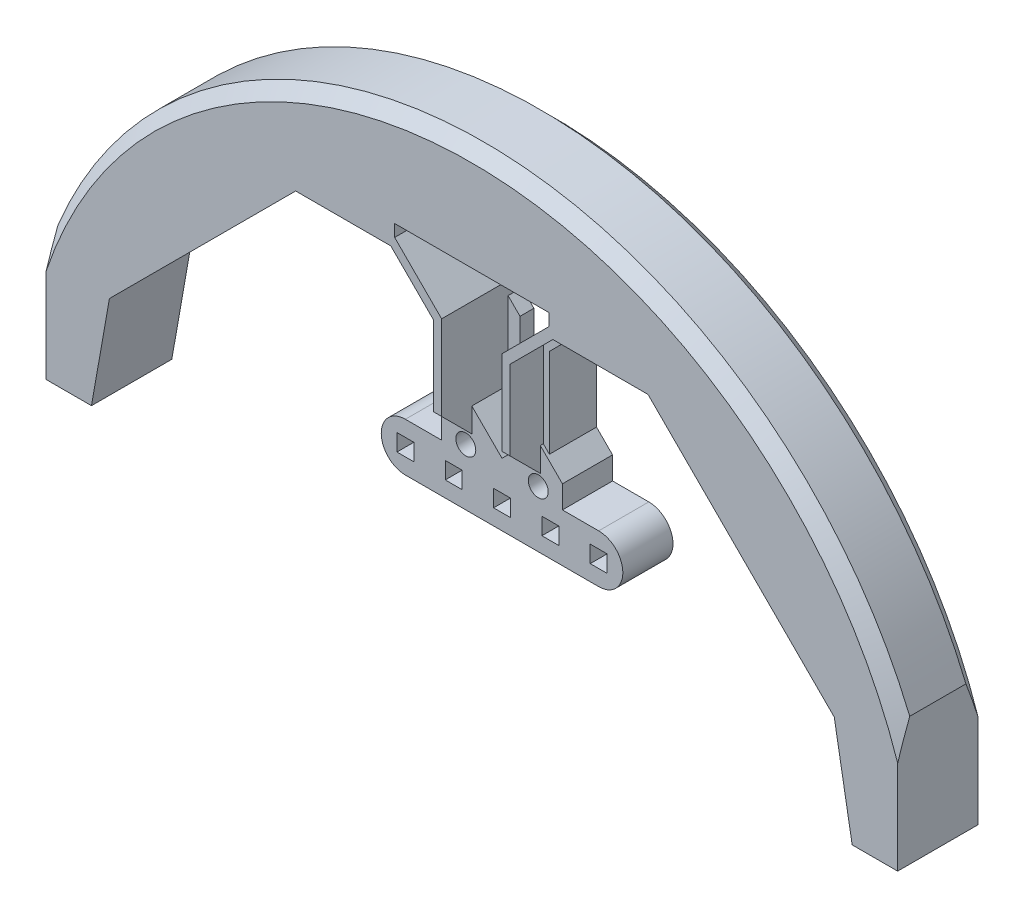
from build123d import *

# Parameters (mm, degrees)
ESBO_O4_R                 = 1.65
RESSALTO_EXTRUS_O1_DEPTH  = 2.3
RESSALTO_EXTRUS_O2_DEPTH  = 3.5
RESSALTO_EXTRUS_O3_DEPTH  = 11
CORTE_EXTRUS_O1_DEPTH     = 10.5
CORTE_EXTRUS_O2_DEPTH     = 40.5
RESSALTO_EXTRUS_O4_DEPTH  = 2
CHANFRO1_SIZE             = 1
ESBO_O11_R                = 1.65
RESSALTO_EXTRUS_O5_DEPTH  = 6
RESSALTO_EXTRUS_O6_DEPTH  = 7
CORTE_EXTRUS_O3_DEPTH     = 94.096670187
RESSALTO_EXTRUS_O7_DEPTH  = 2.3
ESBO_O16_W                = 2.8
ESBO_O16_H                = 2.8
RESSALTO_EXTRUS_O8_DEPTH  = 8.3
ESBO_O17_W                = 2.8
ESBO_O17_H                = 2.8
CORTE_EXTRUS_O4_DEPTH     = 94.002096751
CORTE_EXTRUS_O5_DEPTH     = 11
RESSALTO_EXTRUS_O9_DEPTH  = 2.3
RESSALTO_EXTRUS_O10_DEPTH = 11
RESSALTO_EXTRUS_O11_DEPTH = 2
RESSALTO_EXTRUS_O12_DEPTH = 9
RESSALTO_EXTRUS_O13_DEPTH = 5
CORTE_EXTRUS_O6_REACH     = 107.129
ESBO_O26_W                = 10.5
ESBO_O26_H                = 1.2
RESSALTO_EXTRUS_O14_DEPTH = 11
CORTE_EXTRUS_O7_DEPTH     = 101.585237485
RESSALTO_EXTRUS_O15_DEPTH = 11
RESSALTO_EXTRUS_O16_DEPTH = 13.3
CORTE_EXTRUS_O8_START     = -11
CORTE_EXTRUS_O8_DEPTH     = 11
RESSALTO_EXTRUS_O17_START = -2
RESSALTO_EXTRUS_O17_DEPTH = 2
CHANFRO2_SIZE             = 2
CHANFRO3_SIZE             = 2
RESSALTO_EXTRUS_O18_DEPTH = 2.3
RESSALTO_EXTRUS_O19_DEPTH = 3.5
RESSALTO_EXTRUS_O20_DEPTH = 2
RESSALTO_EXTRUS_O23_DEPTH = 1.5


with BuildPart() as part:
    # Esboço4 → Ressalto-extrusão1 (new body)
    with BuildSketch(Plane.XY):
        Polygon((70, 0), (70, 28.994949366), (28.994949366, 70), (-28.994949366, 70), (-70, 28.994949366), (-70, 0), (-60, 0), (-60, 24.852813742), (-42.426406871, 42.426406871), (-31.166522241, 53.686291501), (-14.242640687, 53.686291501), (-10, 49.443650814), (-10, 24.443650814), (10, 24.443650814), (10, 49.443650814), (14.242640687, 53.686291501), (31.166522241, 53.686291501), (42.426406871, 42.426406871), (60, 24.852813742), (60, 0), align=None)
        with Locations((6, 28.443650814)):
            Circle(ESBO_O4_R, mode=Mode.SUBTRACT)
        with Locations(Location((-6, 28.443650814, 0), (0, 0, 180))):
            Circle(ESBO_O4_R, mode=Mode.SUBTRACT)
        Polygon((-9.894556364, 62.105443636), (9.894556364, 62.105443636), (12.778174593, 59.221825407), (12.778174593, 57.221825407), (5, 49.443650814), (5, 34.443650814), (0, 29.443650814), (-5, 34.443650814), (-5, 49.443650814), (-12.778174593, 57.221825407), (-12.778174593, 59.221825407), align=None, mode=Mode.SUBTRACT)
    extrude(amount=RESSALTO_EXTRUS_O1_DEPTH)

    # Esboço6 → Ressalto-extrusão2 (add)
    with BuildSketch(Plane.XY.offset(2.3)):
        Polygon((-10, 49.443650814), (-14.242640687, 53.686291501), (-31.166522241, 53.686291501), (-35.409162928, 49.443650814), (-36.823376491, 50.857864376), (-31.994949366, 55.686291501), (-31.166522241, 55.686291501), (-13.414213562, 55.686291501), (-8.585786438, 50.857864376), align=None)
        Polygon((8.585786438, 50.857864376), (13.414213562, 55.686291501), (31.166522241, 55.686291501), (31.994949366, 55.686291501), (36.823376491, 50.857864376), (35.409162928, 49.443650814), (31.166522241, 53.686291501), (14.242640687, 53.686291501), (10, 49.443650814), align=None)
    extrude(amount=RESSALTO_EXTRUS_O2_DEPTH)

    # Esboço7 → Ressalto-extrusão3 (add)
    with BuildSketch(Plane.XY.offset(2.3)):
        Polygon((27.130988335, 65.5), (-27.130988335, 65.5), (-65.5, 27.130988335), (-65.5, 0), (-62.5, 0), (-62.5, 25.888347648), (-25.888347648, 62.5), (25.888347648, 62.5), (62.5, 25.888347648), (62.5, 0), (65.5, 0), (65.5, 27.130988335), align=None)
    extrude(amount=RESSALTO_EXTRUS_O3_DEPTH)

    # Esboço8 → Corte-extrusão1 (cut)
    with BuildSketch(Plane.XY.offset(2.3)):
        Polygon((-65.5, 0), (-65.5, 27.130988335), (-27.130988335, 65.5), (27.130988335, 65.5), (65.5, 27.130988335), (65.5, 0), (65.5, -7.47317723), (91.763905533, -7.47317723), (91.763905533, 81.084833901), (-91.763905533, 81.084833901), (-91.763905533, -7.47317723), (-65.5, -7.47317723), align=None)
    extrude(amount=-CORTE_EXTRUS_O1_DEPTH, mode=Mode.SUBTRACT)

    # Esboço9 → Corte-extrusão2 (cut)
    with BuildSketch(Plane(origin=(0, 0, 0), x_dir=(-1, 0, 0), z_dir=(0, 0, -1))):
        Polygon((60, 0), (70, 0), (70, 8.000623443), (-93.298268705, 8.000623443), (-93.298268705, 0), align=None)
    extrude(amount=-CORTE_EXTRUS_O2_DEPTH, mode=Mode.SUBTRACT)

    # Esboço10 → Ressalto-extrusão4 (add)
    with BuildSketch(Plane.XY.offset(13.3)):
        Polygon((-62.5, 8.000623443), (-62.5, 25.888347648), (-25.888347648, 62.5), (25.888347648, 62.5), (62.5, 25.888347648), (62.5, 8.000623443), (60, 8.000623443), (60, 24.852813742), (24.852813742, 60), (-24.852813742, 60), (-60, 24.852813742), (-60, 8.000623443), align=None)
    extrude(amount=-RESSALTO_EXTRUS_O4_DEPTH)

    # Chanfro1
    chanfro1_edges = [part.edges().sort_by_distance(p)[0] for p in [
        (-62.5, 16.944485546, 11.3),
        (-44.194173824, 44.194173824, 11.3),
        (0, 62.5, 11.3),
        (44.194173824, 44.194173824, 11.3),
        (62.5, 16.944485546, 11.3),
    ]]
    chamfer(chanfro1_edges, length=CHANFRO1_SIZE)

    # Esboço11 → Ressalto-extrusão5 (add)
    with BuildSketch(Plane.XY.offset(2.3)):
        Polygon((-10, 24.443650814), (10, 24.443650814), (10, 34.443650814), (5, 34.443650814), (0, 29.443650814), (-5, 34.443650814), (-10, 34.443650814), align=None)
        with Locations(Location((-6, 28.443650814, 0), (0, 0, 180))):
            Circle(ESBO_O11_R, mode=Mode.SUBTRACT)
        with Locations((6, 28.443650814)):
            Circle(ESBO_O11_R, mode=Mode.SUBTRACT)
    extrude(amount=RESSALTO_EXTRUS_O5_DEPTH)

    # Esboço12 → Ressalto-extrusão6 (add)
    with BuildSketch(Plane.XY.offset(2.3)):
        Polygon((-5, 34.443650814), (-5, 49.443650814), (-12.778174593, 57.221825407), (-12.778174593, 62.936367936), (-14.778174593, 62.936367936), (-14.778174593, 55.686291501), (-13.414213562, 55.686291501), (-6.343145751, 48.615223689), (-6.343145751, 34.443650814), align=None)
        Polygon((6.343145751, 34.443650814), (5, 34.443650814), (5, 49.443650814), (12.778174593, 57.221825407), (12.778174593, 62.936367936), (14.778174593, 62.936367936), (14.778174593, 55.686291501), (13.414213562, 55.686291501), (6.343145751, 48.615223689), align=None)
    extrude(amount=RESSALTO_EXTRUS_O6_DEPTH)

    # Esboço14 → Corte-extrusão3 (cut, through all)
    with BuildSketch(Plane.XY.offset(9.3)):
        Polygon((14.242640687, 53.686291501), (12.828427125, 53.686291501), (6.343145751, 47.201010127), (6.343145751, 34.443650814), (18.19110406, 22.595692505), align=None)
        Polygon((-14.242640687, 53.686291501), (-18.19110406, 22.595692505), (-6.343145751, 34.443650814), (-6.343145751, 47.201010127), (-12.828427125, 53.686291501), align=None)
    extrude(amount=-CORTE_EXTRUS_O3_DEPTH, mode=Mode.SUBTRACT)

    # Esboço15 → Ressalto-extrusão7 (add)
    with BuildSketch(Plane.XY.offset(2.3)):
        Polygon((-5, 47.272077939), (-3.023616976, 45.295694915), (-3.023616976, 32.46726779), (-5, 34.443650814), align=None)
        Polygon((5, 34.443650814), (5, 47.272077939), (3.023616976, 45.295694915), (3.023616976, 32.46726779), align=None)
    extrude(amount=-RESSALTO_EXTRUS_O7_DEPTH)

    # Esboço16 → Ressalto-extrusão8 (add)
    with BuildSketch(Plane(origin=(0, 0, 0), x_dir=(-1, 0, 0), z_dir=(0, 0, -1))):
        with BuildLine():
            Line((-16, 27.043650814), (-10, 27.043650814))
            Line((-10, 27.043650814), (-10, 24.443650814))
            Line((-10, 24.443650814), (10, 24.443650814))
            Line((10, 24.443650814), (10, 27.043650814))
            Line((10, 27.043650814), (16, 27.043650814))
            ThreePointArc((16, 27.043650814), (20, 23.043650814), (16, 19.043650814))
            Line((16, 19.043650814), (-16, 19.043650814))
            ThreePointArc((-16, 19.043650814), (-20, 23.043650814), (-16, 27.043650814))
        make_face()
        with Locations((-16, 23.043650814)):
            Rectangle(ESBO_O16_W, ESBO_O16_H, mode=Mode.SUBTRACT)
        with Locations((16, 23.043650814)):
            Rectangle(ESBO_O16_W, ESBO_O16_H, mode=Mode.SUBTRACT)
    extrude(amount=-RESSALTO_EXTRUS_O8_DEPTH)

    # Esboço17 → Corte-extrusão4 (cut, through all)
    with BuildSketch(Plane.XY.offset(8.3)):
        with Locations((0, 23.043650814)):
            Rectangle(ESBO_O17_W, ESBO_O17_H)
        with Locations((-8, 23.043650814)):
            Rectangle(ESBO_O17_W, ESBO_O17_H)
        with Locations((8, 23.043650814)):
            Rectangle(ESBO_O17_W, ESBO_O17_H)
    extrude(amount=-CORTE_EXTRUS_O4_DEPTH, mode=Mode.SUBTRACT)

    # Esboço18 → Corte-extrusão5 (cut)
    with BuildSketch(Plane.XY.offset(13.3)):
        Polygon((14.778174593, 60), (24.852813742, 60), (60, 24.852813742), (60, 8.000623443), (65.5, 8.000623443), (65.5, 27.130988335), (27.130988335, 65.5), (14.778174593, 65.5), (14.778174593, 62.5), align=None)
        Polygon((-27.130988335, 65.5), (-65.5, 27.130988335), (-65.5, 8.000623443), (-60, 8.000623443), (-60, 24.852813742), (-24.852813742, 60), (-14.778174593, 60), (-14.778174593, 62.5), (-14.778174593, 65.5), align=None)
        Polygon((12.778174593, 65.5), (-12.778174593, 65.5), (-12.778174593, 62.5), (-12.778174593, 60), (12.778174593, 60), (12.778174593, 62.5), align=None)
    extrude(amount=-CORTE_EXTRUS_O5_DEPTH, mode=Mode.SUBTRACT)

    # Esboço19 → Ressalto-extrusão9 (add)
    with BuildSketch(Plane(origin=(0, 0, 0), x_dir=(-1, 0, 0), z_dir=(0, 0, -1))):
        Polygon((-65.5, 27.130988335), (-65.5, 8.000623443), (-70.5, 8.000623443), (-70.5, 29.202056147), (-29.202056147, 70.5), (29.202056147, 70.5), (70.5, 29.202056147), (70.5, 8.000623443), (65.5, 8.000623443), (65.5, 27.130988335), (27.130988335, 65.5), (-27.130988335, 65.5), align=None)
    extrude(amount=-RESSALTO_EXTRUS_O9_DEPTH)

    # Esboço20 → Ressalto-extrusão10 (add)
    with BuildSketch(Plane.XY.offset(2.3)):
        Polygon((-70.5, 8.000623443), (-70.5, 29.202056147), (-29.202056147, 70.5), (29.202056147, 70.5), (70.5, 29.202056147), (70.5, 8.000623443), (68.5, 8.000623443), (68.5, 28.373629023), (28.373629023, 68.5), (-28.373629023, 68.5), (-68.5, 28.373629023), (-68.5, 8.000623443), align=None)
    extrude(amount=RESSALTO_EXTRUS_O10_DEPTH)

    # Esboço21 → Ressalto-extrusão11 (add)
    with BuildSketch(Plane.XY.offset(13.3)):
        Polygon((-14.778174593, 55.686291501), (-12.778174593, 55.686291501), (-12.778174593, 59.221825407), (-9.894556364, 62.105443636), (9.894556364, 62.105443636), (12.778174593, 59.221825407), (12.778174593, 55.686291501), (14.778174593, 55.686291501), (29.166522241, 55.686291501), (31.166522241, 53.686291501), (60, 24.852813742), (60, 8.000623443), (68.5, 8.000623443), (68.5, 28.373629023), (28.373629023, 68.5), (-28.373629023, 68.5), (-68.5, 28.373629023), (-68.5, 8.000623443), (-60, 8.000623443), (-60, 24.852813742), (-31.166522241, 53.686291501), (-29.166522241, 55.686291501), align=None)
    extrude(amount=-RESSALTO_EXTRUS_O11_DEPTH)

    # Esboço22 → Ressalto-extrusão12 (add)
    with BuildSketch(Plane.XY.offset(2.3)):
        Polygon((60, 24.852813742), (60, 8.000623443), (60.9, 8.000623443), (60.9, 25.225605949), (29.539314447, 56.586291501), (13.678174593, 56.586291501), (13.678174593, 59.594617613), (10.26734857, 63.005443636), (-10.26734857, 63.005443636), (-13.678174593, 59.594617613), (-13.678174593, 56.586291501), (-29.539314447, 56.586291501), (-60.9, 25.225605949), (-60.9, 8.000623443), (-60, 8.000623443), (-60, 24.852813742), (-29.166522241, 55.686291501), (-12.778174593, 55.686291501), (-12.778174593, 59.221825407), (-9.894556364, 62.105443636), (9.894556364, 62.105443636), (12.778174593, 59.221825407), (12.778174593, 55.686291501), (29.166522241, 55.686291501), align=None)
    extrude(amount=RESSALTO_EXTRUS_O12_DEPTH)

    # Esboço24 → Ressalto-extrusão13 (add)
    with BuildSketch(Plane.XY.offset(8.3)):
        Polygon((-12.778174593, 57.221825407), (-12.778174593, 55.686291501), (-13.414213562, 55.686291501), (-6.343145751, 48.615223689), (-6.343145751, 34.443650814), (-6.343145751, 30.443650814), (-5, 30.443650814), (-5, 34.443650814), (-5, 49.443650814), align=None)
        Polygon((12.778174593, 55.686291501), (12.778174593, 57.221825407), (5, 49.443650814), (5, 34.443650814), (5, 30.443650814), (6.343145751, 30.443650814), (6.343145751, 34.443650814), (6.343145751, 48.615223689), (13.414213562, 55.686291501), align=None)
    extrude(amount=RESSALTO_EXTRUS_O13_DEPTH)

    # Corte-extrusão6: up to this face of the body (flat: up to its plane)
    corte_extrus_o6_end = Plane(part.part.faces().sort_by_distance((6.343145751, 40.542913033, 7.141595678))[0])
    # Esboço25 → Corte-extrusão6 (cut, up to the picked face)
    with BuildSketch(Plane.ZY.offset(6.343145751), mode=Mode.PRIVATE) as corte_extrus_o6_sk1:
        Polygon((8.3, 30.443650814), (13.3, 30.443650814), (13.3, 35.443650814), align=None)
    corte_extrus_o6_tool1 = split(extrude(corte_extrus_o6_sk1.sketch, amount=-CORTE_EXTRUS_O6_REACH, mode=Mode.PRIVATE), bisect_by=corte_extrus_o6_end, keep=Keep.BOTH, mode=Mode.PRIVATE)
    add(corte_extrus_o6_tool1.solids().sort_by(Axis((-6.343146, 32.110317, 11.633333), (1, 0, 0)))[0], mode=Mode.SUBTRACT)

    # Esboço26 → Ressalto-extrusão14 (add)
    with BuildSketch(Plane.XY.offset(13.3)):
        with Locations((-65.25, 24.252813742)):
            Rectangle(ESBO_O26_W, ESBO_O26_H)
        with Locations((65.25, 24.252813742)):
            Rectangle(ESBO_O26_W, ESBO_O26_H)
    extrude(amount=-RESSALTO_EXTRUS_O14_DEPTH)

    # Esboço27 → Corte-extrusão7 (cut, through all)
    with BuildSketch(Plane.XY.offset(13.3)):
        Polygon((-60, 24.852813742), (-65.050320566, -3.788977466), (-60, -3.788977466), align=None)
        Polygon((60, -3.788977466), (60, 24.852813742), (65.050320566, -3.788977466), align=None)
    extrude(amount=-CORTE_EXTRUS_O7_DEPTH, mode=Mode.SUBTRACT)

    # Esboço28 → Ressalto-extrusão15 (add)
    with BuildSketch(Plane.XY.offset(13.3)):
        Polygon((-60, 24.852813742), (-60.886326978, 25.009097102), (-63.885379784, 8.000623443), (-62.971495834, 8.000623443), align=None)
        Polygon((62.971495834, 8.000623443), (60, 24.852813742), (60.886326978, 25.009097102), (63.885379784, 8.000623443), align=None)
    extrude(amount=-RESSALTO_EXTRUS_O15_DEPTH)

    # Esboço29 → Ressalto-extrusão16 (add)
    with BuildSketch(Plane(origin=(0, 0, 0), x_dir=(-1, 0, 0), z_dir=(0, 0, -1))):
        with BuildLine():
            ThreePointArc((70.5, 29.202056147), (53.958363963, 53.958363963), (29.202056147, 70.5))
            Line((29.202056147, 70.5), (70.5, 29.202056147))
        make_face()
        with BuildLine():
            ThreePointArc((29.202056147, 70.5), (0, 76.308650121), (-29.202056147, 70.5))
            Line((-29.202056147, 70.5), (29.202056147, 70.5))
        make_face()
        with BuildLine():
            Line((-70.5, 29.202056147), (-29.202056147, 70.5))
            ThreePointArc((-29.202056147, 70.5), (-53.958363963, 53.958363963), (-70.5, 29.202056147))
        make_face()
    extrude(amount=-RESSALTO_EXTRUS_O16_DEPTH)

    # Esboço31 → Corte-extrusão8 (cut)
    with BuildSketch(Plane.XY.offset(13.3).offset(CORTE_EXTRUS_O8_START)):
        with BuildLine():
            Line((-68.652240935, 28.436689283), (-61.261204675, 25.375221824))
            ThreePointArc((-61.261204675, 25.375221824), (0, 66.308650121), (61.261204675, 25.375221824))
            Line((61.261204675, 25.375221824), (68.652240935, 28.436689283))
            ThreePointArc((68.652240935, 28.436689283), (0, 74.308650121), (-68.652240935, 28.436689283))
        make_face()
    extrude(amount=CORTE_EXTRUS_O8_DEPTH, mode=Mode.SUBTRACT)

    # Esboço32 → Ressalto-extrusão17 (add)
    with BuildSketch(Plane.XY.offset(13.3).offset(RESSALTO_EXTRUS_O17_START)):
        with BuildLine():
            Line((-68.652240935, 28.436689283), (-61.261204675, 25.375221824))
            ThreePointArc((-61.261204675, 25.375221824), (0, 66.308650121), (61.261204675, 25.375221824))
            Line((61.261204675, 25.375221824), (68.652240935, 28.436689283))
            ThreePointArc((68.652240935, 28.436689283), (0, 74.308650121), (-68.652240935, 28.436689283))
        make_face()
    extrude(amount=RESSALTO_EXTRUS_O17_DEPTH)

    # Chanfro2
    chanfro2_edges = [part.edges().sort_by_distance(p)[0] for p in [
        (0, 76.308650121, 13.3),
    ]]
    chamfer(chanfro2_edges, length=CHANFRO2_SIZE)

    # Chanfro3
    chanfro3_edges = [part.edges().sort_by_distance(p)[0] for p in [
        (0, 76.308650121, 0),
    ]]
    chamfer(chanfro3_edges, length=CHANFRO3_SIZE)

    # Esboço33 → Ressalto-extrusão18 (add)
    with BuildSketch(Plane(origin=(0, 0, 0), x_dir=(-1, 0, 0), z_dir=(0, 0, -1))):
        Polygon((6.343145751, 34.443650814), (6.343145751, 32.443650814), (7.343145751, 32.443650814), (7.343145751, 49.95835255), (6.343145751, 49.95835255), align=None)
        Polygon((-6.343145751, 49.95835255), (-6.343145751, 34.443650814), (-6.343145751, 32.443650814), (-7.343145751, 32.443650814), (-7.343145751, 49.95835255), align=None)
    extrude(amount=-RESSALTO_EXTRUS_O18_DEPTH)

    # Esboço34 → Ressalto-extrusão19 (add)
    with BuildSketch(Plane.XY.offset(2.3)):
        Polygon((-9.292893219, 50.150757595), (-7.343145751, 48.201010127), (-7.343145751, 33.443650814), (-6.343145751, 34.443650814), (-6.343145751, 48.615223689), (-8.585786438, 50.857864376), align=None)
        Polygon((9.292893219, 50.150757595), (8.585786438, 50.857864376), (6.343145751, 48.615223689), (6.343145751, 34.443650814), (7.343145751, 33.443650814), (7.343145751, 48.201010127), align=None)
    extrude(amount=RESSALTO_EXTRUS_O19_DEPTH)

    # Esboço35 → Ressalto-extrusão20 (add)
    with BuildSketch(Plane.XY.offset(5.8)):
        Polygon((-29.166522241, 55.686291501), (-31.166522241, 53.686291501), (-12.828427125, 53.686291501), (-7.343145751, 48.201010127), (-7.343145751, 33.443650814), (-6.343145751, 34.443650814), (-6.343145751, 48.615223689), (-13.414213562, 55.686291501), align=None)
        Polygon((12.828427125, 53.686291501), (31.166522241, 53.686291501), (29.166522241, 55.686291501), (13.414213562, 55.686291501), (6.343145751, 48.615223689), (6.343145751, 34.443650814), (7.343145751, 33.443650814), (7.343145751, 48.201010127), align=None)
    extrude(amount=RESSALTO_EXTRUS_O20_DEPTH)

    # Esboço39 → Ressalto-extrusão23 (add)
    with BuildSketch(Plane.XY.offset(13.3)):
        Polygon((-12.778174593, 59.221825407), (12.778174593, 59.221825407), (9.894556364, 62.105443636), (-9.894556364, 62.105443636), align=None)
    extrude(amount=-RESSALTO_EXTRUS_O23_DEPTH)


solid = part.part
